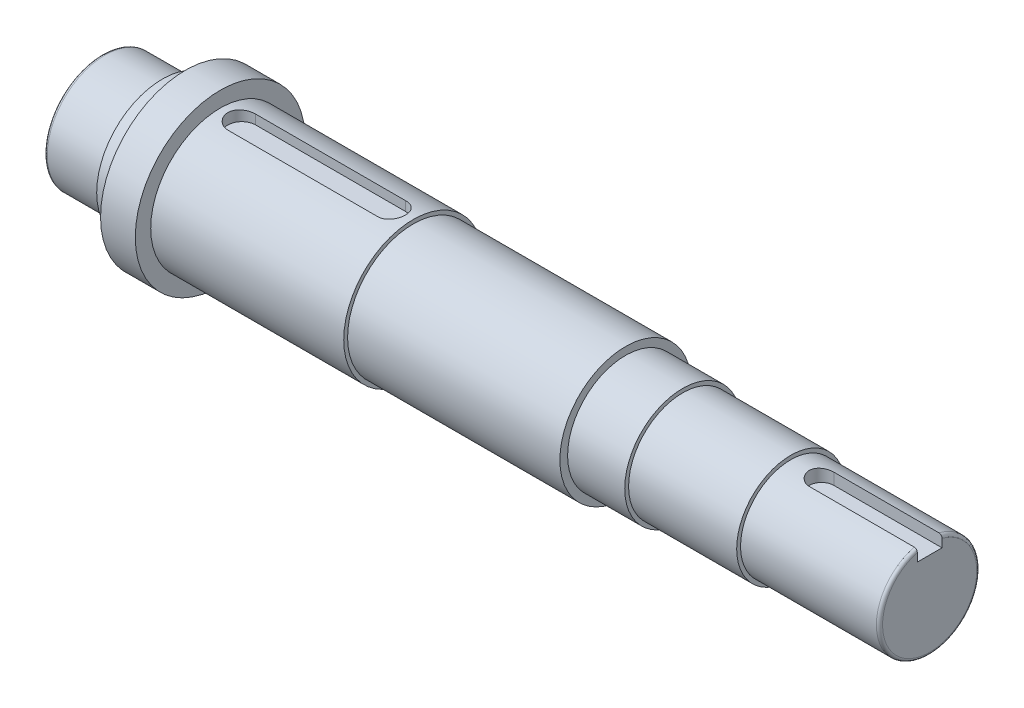
from build123d import *

# Parameters (mm, degrees)
FILLET1_R          = 2
CUT_EXTRUDE1_DEPTH = 7
CUT_EXTRUDE2_DEPTH = 8.42


with BuildPart() as part:
    # Sketch1 → Revolve1 (revolve)
    with BuildSketch(Plane.XY, mode=Mode.PRIVATE) as revolve1_sk:
        Polygon((-305.228973115, 0), (-305.228973115, 37.5), (-266.228973115, 37.5), (-266.228973115, 42.5), (-251.228973115, 42.5), (-251.228973115, 55), (-228.728973115, 55), (-228.728973115, 45), (-103.728973115, 45), (-103.728973115, 42.5), (33.771026885, 42.5), (33.771026885, 37.5), (70.771026885, 37.5), (70.771026885, 35), (140.771026885, 35), (140.771026885, 32.5), (230.771026885, 32.5), (230.771026885, 0), align=None)
    revolve(revolve1_sk.sketch.rotate(Axis((-305.228973115, 0, 0), (1, 0, 0)), 90), axis=Axis((-305.228973115, 0, 0), (1, 0, 0)))

    # Fillet1
    fillet1_edges = [part.edges().sort_by_distance(p)[0] for p in [
        (230.771026885, 0, -32.5),
        (-305.228973115, 0, -37.5),
    ]]
    fillet(fillet1_edges, radius=FILLET1_R)

    # Sketch2 → Cut-Extrude1 (cut)
    with BuildSketch(Plane(origin=(0, 45, 0), x_dir=(1, 0, 0), z_dir=(0, 1, 0))):
        with BuildLine():
            Line((-214.728973115, 9), (-117.728973115, 9))
            ThreePointArc((-117.728973115, 9), (-108.728973115, 0), (-117.728973115, -9))
            Line((-117.728973115, -9), (-214.728973115, -9))
            ThreePointArc((-214.728973115, -9), (-223.728973115, 0), (-214.728973115, 9))
        make_face()
    extrude(amount=-CUT_EXTRUDE1_DEPTH, mode=Mode.SUBTRACT)

    # Sketch3 → Cut-Extrude2 (cut)
    with BuildSketch(Plane(origin=(0, 32.5, 0), x_dir=(1, 0, 0), z_dir=(0, 1, 0))):
        with BuildLine():
            Line((160.771026885, 8), (239.672202356, 8))
            ThreePointArc((239.672202356, 8), (247.672202356, 0), (239.672202356, -8))
            Line((239.672202356, -8), (160.771026885, -8))
            ThreePointArc((160.771026885, -8), (152.771026885, 0), (160.771026885, 8))
        make_face()
    extrude(amount=-CUT_EXTRUDE2_DEPTH, mode=Mode.SUBTRACT)


solid = part.part
